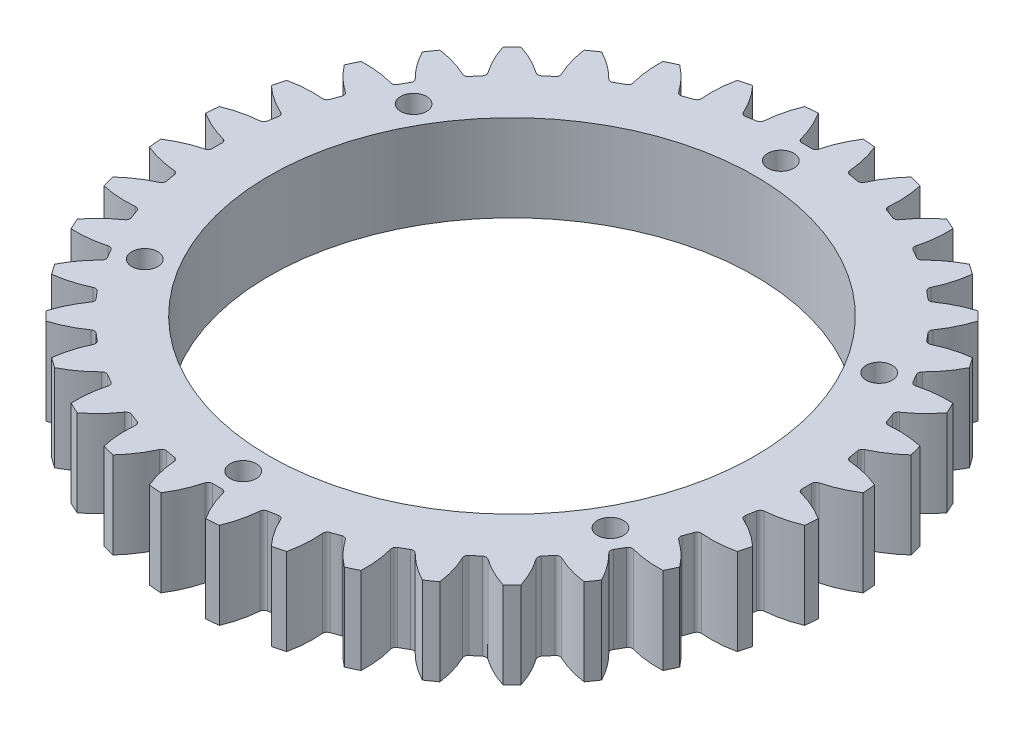
from build123d import *

# Parameters (mm, degrees)
SKETCH_1_R               = 38
SKETCH_1_R_2             = 28
SKETCH_1_R_3             = 1.5
EXTRUDE_1_DEPTH          = 10
CUT_EXTRUDE_1_DEPTH      = 55.662601475
PATTERN_CIRCULAR_1_COUNT = 36


with BuildPart() as part:
    # 草图1 → 凸台-拉伸1 (new body)
    with BuildSketch(Plane(origin=(0, 0, 0), x_dir=(1, 0, 0), z_dir=(0, 1, 0))):
        with Locations(Location((0, 0, 0), (0, 0, 270))):
            Circle(SKETCH_1_R)
        with Locations(Location((0, 0, 0), (0, 0, 270))):
            Circle(SKETCH_1_R_2, mode=Mode.SUBTRACT)
        with Locations(Location((0, 31, 0), (0, 0, 270))):
            Circle(SKETCH_1_R_3, mode=Mode.SUBTRACT)
        with Locations(Location((26.846787517, 15.5, 0), (0, 0, 270))):
            Circle(SKETCH_1_R_3, mode=Mode.SUBTRACT)
        with Locations(Location((26.846787517, -15.5, 0), (0, 0, 270))):
            Circle(SKETCH_1_R_3, mode=Mode.SUBTRACT)
        with Locations(Location((0, -31, 0), (0, 0, 270))):
            Circle(SKETCH_1_R_3, mode=Mode.SUBTRACT)
        with Locations(Location((-26.846787517, -15.5, 0), (0, 0, 270))):
            Circle(SKETCH_1_R_3, mode=Mode.SUBTRACT)
        with Locations(Location((-26.846787517, 15.5, 0), (0, 0, 270))):
            Circle(SKETCH_1_R_3, mode=Mode.SUBTRACT)
    extrude(amount=EXTRUDE_1_DEPTH)

    # 草图2 → 切除-拉伸1 (cut, through all)
    with BuildSketch(Plane(origin=(0, 0, 0), x_dir=(1, 0, 0), z_dir=(0, 1, 0))):
        with BuildLine():
            ThreePointArc((2.588370465, 37.911744069), (0, 38), (-2.588370465, 37.911744069))
            ThreePointArc((-2.588370465, 37.911744069), (-1.671005464, 36.20187222), (-1.03366082, 34.369111437))
            ThreePointArc((-1.03366082, 34.369111437), (-0.852336111, 34.097433433), (-0.541959095, 33.995680319))
            ThreePointArc((-0.541959095, 33.995680319), (0, 34), (0.541959095, 33.995680319))
            ThreePointArc((0.541959095, 33.995680319), (0.852336111, 34.097433433), (1.03366082, 34.369111437))
            ThreePointArc((1.03366082, 34.369111437), (1.671005464, 36.20187222), (2.588370465, 37.911744069))
        make_face()
    cut_extrude_1 = extrude(amount=CUT_EXTRUDE_1_DEPTH, mode=Mode.SUBTRACT)

    # 阵列(圆周)1: 切除-拉伸1 ×36 about axis
    pattern_circular_1_axis = Axis((0, 0, 0), (0, 1, 0))
    for i in range(1, PATTERN_CIRCULAR_1_COUNT):
        add(cut_extrude_1.rotate(pattern_circular_1_axis, i * 360 / PATTERN_CIRCULAR_1_COUNT), mode=Mode.SUBTRACT)


solid = part.part
